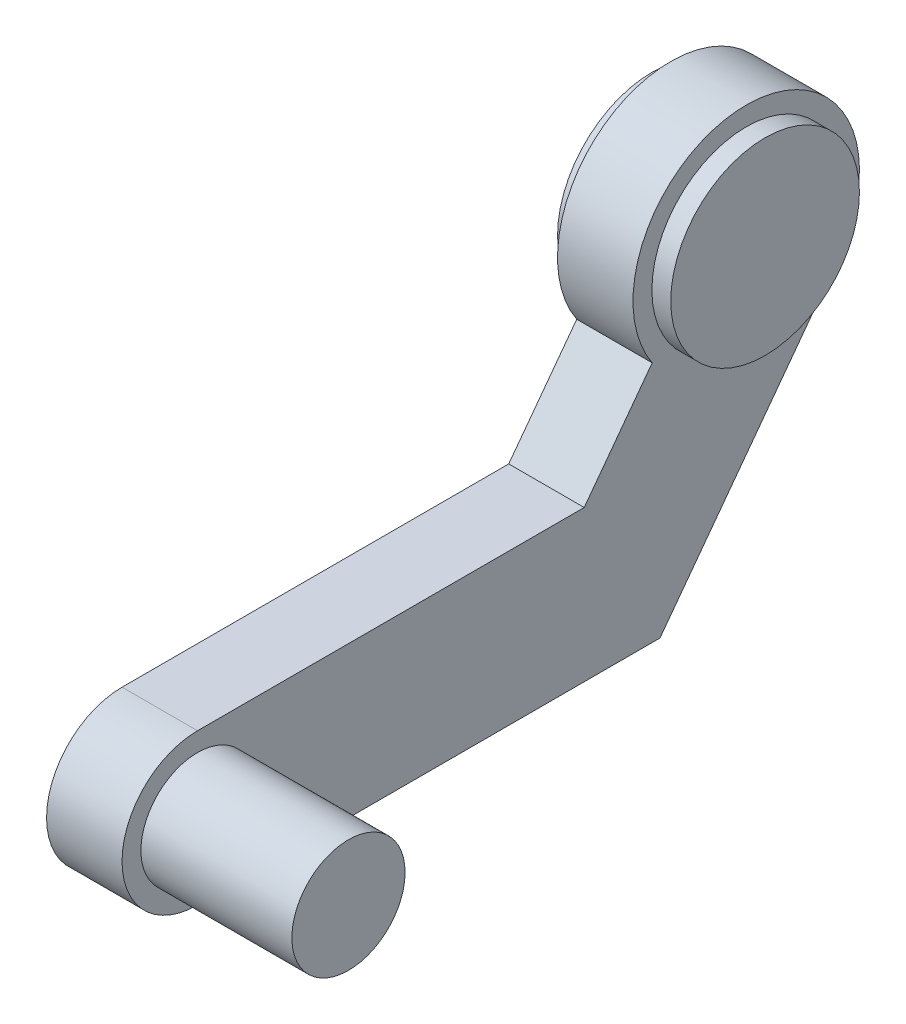
from build123d import *

# Parameters (mm, degrees)
SKETCH1_R           = 4
SKETCH1_R_2         = 3
SKETCH1_R_3         = 6
SKETCH1_R_4         = 5
BOSS_EXTRUDE1_DEPTH = 2
SKETCH1_3_R         = 5
BOSS_EXTRUDE2_DEPTH = 3
BOSS_EXTRUDE3_START = -2
SKETCH1_4_R         = 3
BOSS_EXTRUDE3_DEPTH = 12


with BuildPart() as part:
    # Sketch1 → Boss-Extrude1 (new, symmetric)
    # profile 1 of 3: a face of its own
    with BuildSketch(Plane.YZ):
        with BuildLine():
            ThreePointArc((-8.18, 29.08), (-12.18, 25.08), (-16.18, 29.08))
            Line((-16.18, 29.08), (-16.18, 4.569972731))
            Line((-16.18, 4.569972731), (-3.584071428, -4.811905236))
            ThreePointArc((-3.584071428, -4.811905236), (-5.998168777, 0.148227284), (-3.342017287, 4.98306336))
            Line((-3.342017287, 4.98306336), (-8.18, 8.586558185))
            Line((-8.18, 8.586558185), (-8.18, 29.08))
        make_face()
    # profile 2 of 3: a face of its own
    with BuildSketch(Plane.YZ):
        with Locations((-12.18, 29.08)):
            Circle(SKETCH1_R)
        with Locations(Location((-12.18, 29.08, 0), (0, 0, 270))):
            Circle(SKETCH1_R_2, mode=Mode.SUBTRACT)
    # profile 3 of 3: a face of its own
    with BuildSketch(Plane.YZ):
        Circle(SKETCH1_R_3)
        with Locations(Location((0, 0, 0), (0, 0, 270))):
            Circle(SKETCH1_R_4, mode=Mode.SUBTRACT)
    extrude(amount=BOSS_EXTRUDE1_DEPTH, both=True)

    # Sketch1<3> → Boss-Extrude2 (add, symmetric)
    with BuildSketch(Plane.YZ):
        with Locations(Location((0, 0, 0), (0, 0, 270))):
            Circle(SKETCH1_3_R)
    extrude(amount=BOSS_EXTRUDE2_DEPTH, both=True)

    # Sketch1<4> → Boss-Extrude3 (add)
    with BuildSketch(Plane.YZ.offset(BOSS_EXTRUDE3_START)):
        with Locations(Location((-12.18, 29.08, 0), (0, 0, 270))):
            Circle(SKETCH1_4_R)
    extrude(amount=BOSS_EXTRUDE3_DEPTH)


solid = part.part
